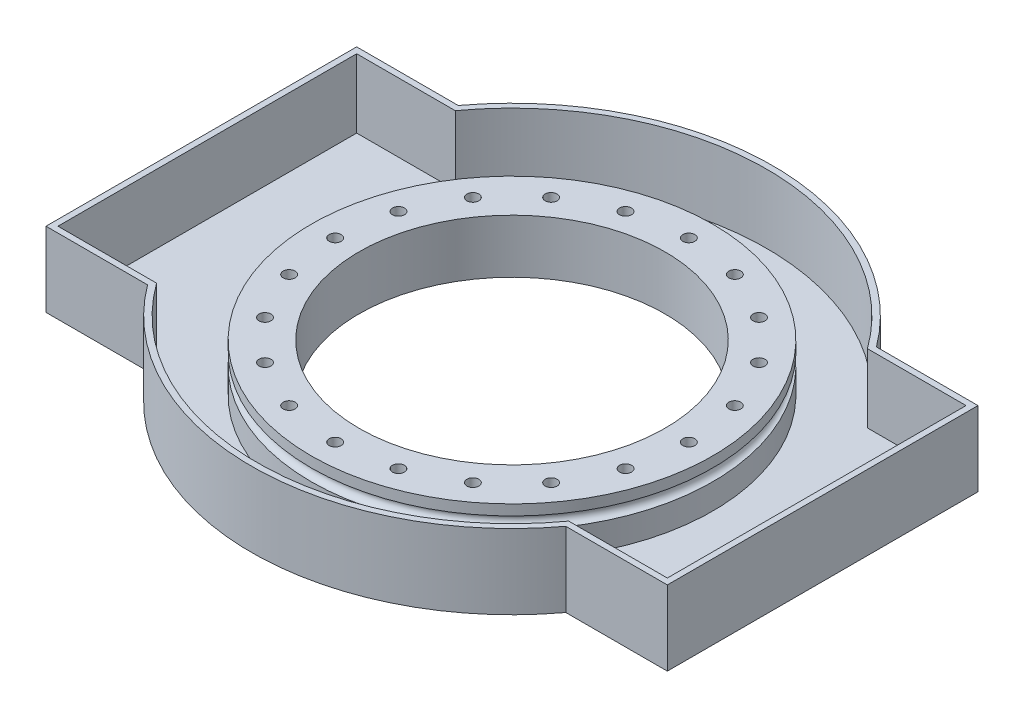
from build123d import *

# Parameters (mm, degrees)
ESQUISSE2_R                  = 10
ENL_V_MAT_EXTRU_1_DEPTH      = 687.62944883
R_P_TITION_CIRCULAIRE1_COUNT = 20
BOSS_EXTRU_1_START           = -10
ESQUISSE5_R                  = 436
ESQUISSE5_R_2                = 336
BOSS_EXTRU_1_DEPTH           = 10
BOSS_EXTRU_2_START           = 115
ESQUISSE6_R                  = 436
ESQUISSE6_R_2                = 426
BOSS_EXTRU_2_DEPTH           = 115
BOSS_EXTRU_3_START           = -10
BOSS_EXTRU_3_DEPTH           = 10
BOSS_EXTRU_4_START           = 115
BOSS_EXTRU_4_DEPTH           = 115
ENL_V_MAT_EXTRU_3_DEPTH      = 115
R_P_TITION_CIRCULAIRE6_COUNT = 2


with BuildPart() as part:
    # Esquisse1 → Révolution1 (revolve)
    with BuildSketch(Plane.XY, mode=Mode.PRIVATE) as r_volution1_sk:
        with BuildLine():
            Line((0, 0), (80, 0))
            Line((80, 0), (80, 52.5))
            ThreePointArc((80, 52.5), (70, 62.5), (80, 72.5))
            Line((80, 72.5), (80, 90))
            Line((80, 90), (0, 90))
            Line((0, 90), (0, 0))
        make_face()
    revolve(r_volution1_sk.sketch.rotate(Axis((-256, 27.419354839, 0), (0, -1, 0)), 90), axis=Axis((-256, 27.419354839, 0), (0, -1, 0)))

    # Esquisse2 → Enlèv. mat.-Extru.1 (cut, through all)
    with BuildSketch(Plane.XZ):
        with Locations(Location((40, 0, 0), (0, 0, 270))):
            Circle(ESQUISSE2_R)
    enl_v_mat_extru_1 = extrude(amount=-ENL_V_MAT_EXTRU_1_DEPTH, mode=Mode.SUBTRACT)

    # Répétition circulaire1: Enlèv. mat.-Extru.1 ×20 about axis
    r_p_tition_circulaire1_axis = Axis((-256, 0, 0), (0, 1, 0))
    for i in range(1, R_P_TITION_CIRCULAIRE1_COUNT):
        add(enl_v_mat_extru_1.rotate(r_p_tition_circulaire1_axis, i * 360 / R_P_TITION_CIRCULAIRE1_COUNT), mode=Mode.SUBTRACT)

    # Esquisse5 → Boss.-Extru.1 (add)
    with BuildSketch(Plane.XZ.offset(BOSS_EXTRU_1_START)):
        with Locations(Location((-256, 0, 0), (0, 0, 270))):
            Circle(ESQUISSE5_R)
        with Locations(Location((-256, 0, 0), (0, 0, 90))):
            Circle(ESQUISSE5_R_2, mode=Mode.SUBTRACT)
    extrude(amount=BOSS_EXTRU_1_DEPTH)

    # Esquisse6 → Boss.-Extru.2 (add)
    with BuildSketch(Plane(origin=(0, 10, 0), x_dir=(1, 0, 0), z_dir=(0, 1, 0)).offset(BOSS_EXTRU_2_START)):
        with Locations(Location((-256, 0, 0), (0, 0, 90))):
            Circle(ESQUISSE6_R)
        with Locations(Location((-256, 0, 0), (0, 0, 270))):
            Circle(ESQUISSE6_R_2, mode=Mode.SUBTRACT)
    extrude(amount=-BOSS_EXTRU_2_DEPTH)

    # Esquisse7 → Boss.-Extru.3 (add)
    with BuildSketch(Plane.XZ.offset(BOSS_EXTRU_3_START)):
        with BuildLine():
            Line((93.994285668, 260), (263.994285668, 260))
            Line((263.994285668, 260), (263.994285668, -260))
            Line((263.994285668, -260), (93.994285668, -260))
            ThreePointArc((93.994285668, -260), (180, 0), (93.994285668, 260))
        make_face()
    boss_extru_3 = extrude(amount=BOSS_EXTRU_3_DEPTH)

    # Esquisse8 → Boss.-Extru.4 (add)
    with BuildSketch(Plane(origin=(0, 10, 0), x_dir=(1, 0, 0), z_dir=(0, 1, 0)).offset(BOSS_EXTRU_4_START)):
        with BuildLine():
            Line((113.345366832, 250), (253.994285668, 250))
            Line((253.994285668, 250), (253.994285668, -250))
            Line((253.994285668, -250), (113.345366832, -250))
            Line((113.345366832, -250), (101.205823021, -250))
            ThreePointArc((101.205823021, -250), (97.635403251, -255.025491996), (93.994285668, -260))
            Line((93.994285668, -260), (263.994285668, -260))
            Line((263.994285668, -260), (263.994285668, 260))
            Line((263.994285668, 260), (93.994285668, 260))
            ThreePointArc((93.994285668, 260), (97.635403251, 255.025491996), (101.205823021, 250))
            Line((101.205823021, 250), (113.345366832, 250))
        make_face()
    boss_extru_4 = extrude(amount=-BOSS_EXTRU_4_DEPTH)

    # Esquisse9 → Enlèv. mat.-Extru.3 (cut)
    with BuildSketch(Plane(origin=(0, 125, 0), x_dir=(1, 0, 0), z_dir=(0, 1, 0))):
        with BuildLine():
            Line((101.205823021, -250), (88.928978197, -250))
            ThreePointArc((88.928978197, -250), (170, 0), (88.928978197, 250))
            Line((88.928978197, 250), (101.205823021, 250))
            ThreePointArc((101.205823021, 250), (180, 0), (101.205823021, -250))
        make_face()
    enl_v_mat_extru_3 = extrude(amount=-ENL_V_MAT_EXTRU_3_DEPTH, mode=Mode.SUBTRACT)

    # Répétition circulaire6: Boss.-Extru.3, Boss.-Extru.4, Enlèv. mat.-Extru.3 ×2 about axis
    r_p_tition_circulaire6_axis = Axis((-256, 0, 0), (0, 1, 0))
    add([boss_extru_3.rotate(r_p_tition_circulaire6_axis, i * 360 / R_P_TITION_CIRCULAIRE6_COUNT) for i in range(1, R_P_TITION_CIRCULAIRE6_COUNT)])
    add([boss_extru_4.rotate(r_p_tition_circulaire6_axis, i * 360 / R_P_TITION_CIRCULAIRE6_COUNT) for i in range(1, R_P_TITION_CIRCULAIRE6_COUNT)])
    add([enl_v_mat_extru_3.rotate(r_p_tition_circulaire6_axis, i * 360 / R_P_TITION_CIRCULAIRE6_COUNT) for i in range(1, R_P_TITION_CIRCULAIRE6_COUNT)], mode=Mode.SUBTRACT)


solid = part.part
